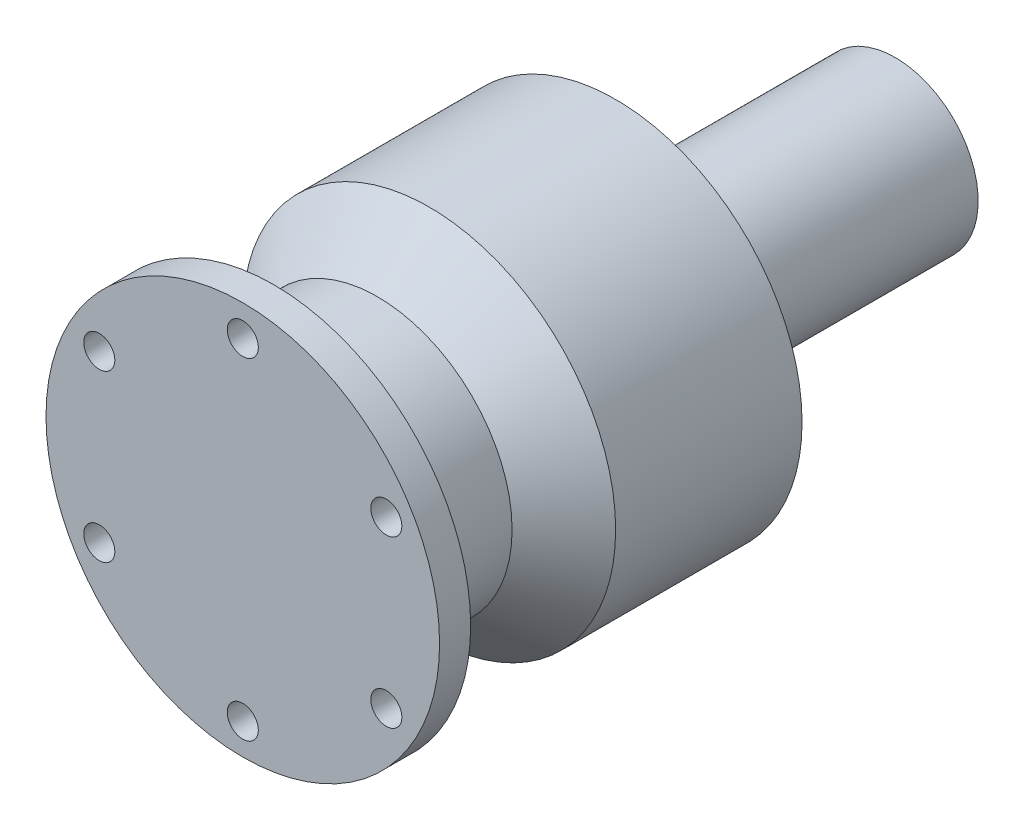
from build123d import *

# Parameters (mm, degrees)
CROQUIS2_R              = 18
SALIENTE_EXTRUIR1_DEPTH = 30
CROQUIS3_R              = 13
SALIENTE_EXTRUIR3_DEPTH = 10
CROQUIS5_R              = 8
SALIENTE_EXTRUIR4_DEPTH = 20
CROQUIS6_OUTSIDE_W      = 69.738
CROQUIS6_OUTSIDE_H      = 69.738
CROQUIS6_OUTSIDE_R      = 13
CORTAR_EXTRUIR2_DEPTH   = 8
CORTAR_EXTRUIR2_DRAFT   = -45
CROQUIS7_OUTSIDE_W      = 76.588
CROQUIS7_OUTSIDE_H      = 76.588
CROQUIS7_OUTSIDE_R      = 8
CORTAR_EXTRUIR5_DEPTH   = 8
CORTAR_EXTRUIR5_DRAFT   = -55
CROQUIS8_R              = 19
SALIENTE_EXTRUIR5_DEPTH = 3
CROQUIS9_R              = 1.5
CORTAR_EXTRUIR6_DEPTH   = 3


with BuildPart() as part:
    # Croquis2 → Saliente-Extruir1 (new body)
    with BuildSketch(Plane.XY):
        Circle(CROQUIS2_R)
    extrude(amount=SALIENTE_EXTRUIR1_DEPTH)

    # Croquis3 → Saliente-Extruir3 (add)
    with BuildSketch(Plane.XY.offset(30)):
        Circle(CROQUIS3_R)
    extrude(amount=SALIENTE_EXTRUIR3_DEPTH)

    # Croquis5 → Saliente-Extruir4 (add)
    with BuildSketch(Plane(origin=(0, 0, 0), x_dir=(-1, 0, 0), z_dir=(0, 0, -1))):
        Circle(CROQUIS5_R)
    extrude(amount=SALIENTE_EXTRUIR4_DEPTH)


with BuildPart() as cortar_extruir2_tool:
    # Croquis6 outside → Cortar-Extruir2 (with draft: the straight prism first)
    with BuildSketch(Plane.XY.offset(30)):
        Rectangle(CROQUIS6_OUTSIDE_W, CROQUIS6_OUTSIDE_H)
        Circle(CROQUIS6_OUTSIDE_R, mode=Mode.SUBTRACT)
    extrude(amount=-CORTAR_EXTRUIR2_DEPTH)
    # Cortar-Extruir2: the draft: its side faces are tilted about the plane it starts from
    cortar_extruir2_sides = [cortar_extruir2_tool.faces().sort_by_distance(p)[0] for p in [
        (0, -34.869, 26),
        (34.869, 0, 26),
        (0, 34.869, 26),
        (-34.869, 0, 26),
        (-13, 0, 26),
    ]]
    draft(cortar_extruir2_sides, Plane.XY.offset(30), CORTAR_EXTRUIR2_DRAFT)


with BuildPart() as part_1:
    add(part.part)

    # Cortar-Extruir2: cut by cortar_extruir2_tool
    add(cortar_extruir2_tool.part, mode=Mode.SUBTRACT)


with BuildPart() as cortar_extruir5_tool:
    # Croquis7 outside → Cortar-Extruir5 (with draft: the straight prism first)
    with BuildSketch(Plane(origin=(0, 0, 0), x_dir=(-1, 0, 0), z_dir=(0, 0, -1))):
        Rectangle(CROQUIS7_OUTSIDE_W, CROQUIS7_OUTSIDE_H)
        Circle(CROQUIS7_OUTSIDE_R, mode=Mode.SUBTRACT)
    extrude(amount=-CORTAR_EXTRUIR5_DEPTH)
    # Cortar-Extruir5: the draft: its side faces are tilted about the plane it starts from
    cortar_extruir5_sides = [cortar_extruir5_tool.faces().sort_by_distance(p)[0] for p in [
        (0, -38.294, 4),
        (-38.294, 0, 4),
        (0, 38.294, 4),
        (38.294, 0, 4),
        (8, 0, 4),
    ]]
    draft(cortar_extruir5_sides, Plane(origin=(0, 0, 0), x_dir=(-1, 0, 0), z_dir=(0, 0, -1)), CORTAR_EXTRUIR5_DRAFT)


with BuildPart() as part_2:
    add(part_1.part)

    # Cortar-Extruir5: cut by cortar_extruir5_tool
    add(cortar_extruir5_tool.part, mode=Mode.SUBTRACT)

    # Croquis8 → Saliente-Extruir5 (add)
    with BuildSketch(Plane.XY.offset(40)):
        Circle(CROQUIS8_R)
    extrude(amount=SALIENTE_EXTRUIR5_DEPTH)

    # Croquis9 → Cortar-Extruir6 (cut)
    with BuildSketch(Plane.XY.offset(43)):
        with Locations((0, 16)):
            Circle(CROQUIS9_R)
        with Locations((13.856406461, 8)):
            Circle(CROQUIS9_R)
        with Locations((13.856406461, -8)):
            Circle(CROQUIS9_R)
        with Locations((0, -16)):
            Circle(CROQUIS9_R)
        with Locations((-13.856406461, -8)):
            Circle(CROQUIS9_R)
        with Locations((-13.856406461, 8)):
            Circle(CROQUIS9_R)
    extrude(amount=-CORTAR_EXTRUIR6_DEPTH, mode=Mode.SUBTRACT)


solid = part_2.part
